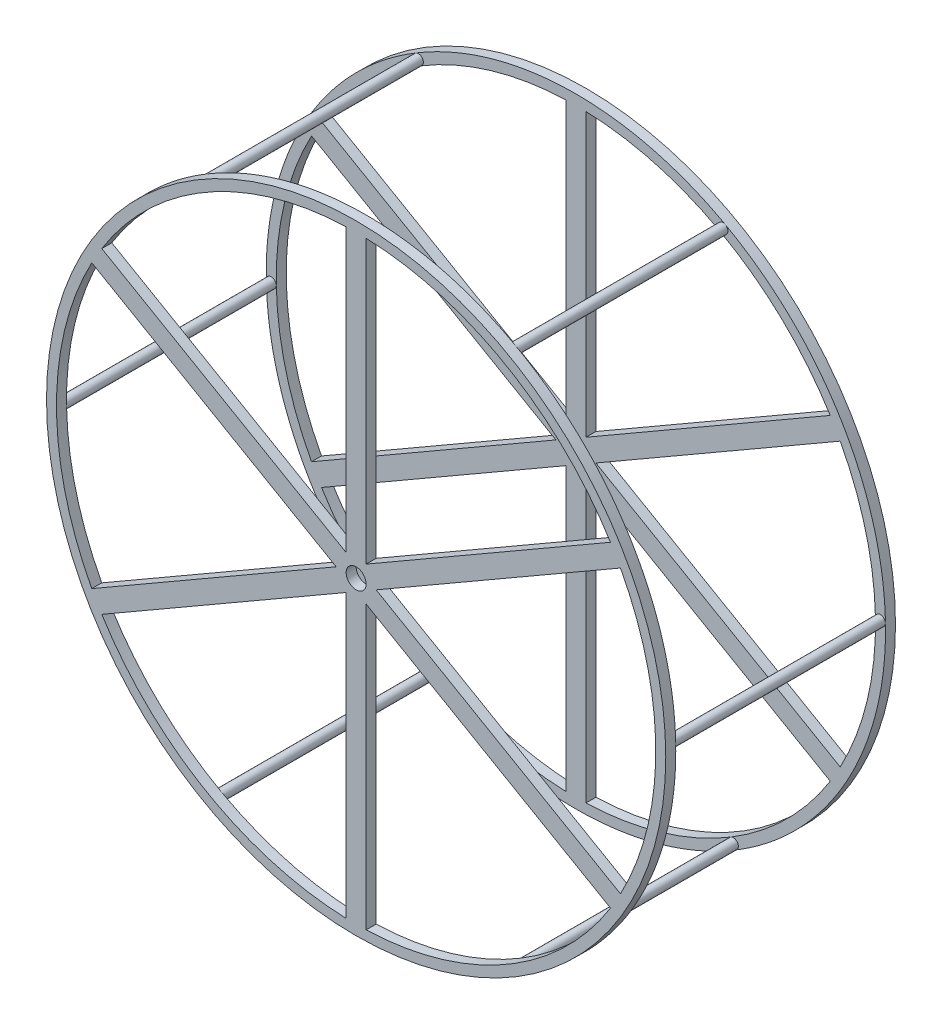
from build123d import *

# Parameters (mm, degrees)
SKETCH1_R               = 155
SKETCH1_R_2             = 150
BOSS_EXTRUDE1_DEPTH     = 115
SKETCH4_W               = 10
SKETCH4_H               = 300
BOSS_EXTRUDE3_DEPTH     = 115
CIRPATTERN1_COUNT       = 3
CIRPATTERN1_ANGLE       = 120
CUT_EXTRUDE1_DEPTH      = 248.53787589
CUT_EXTRUDE1_DEPTH_BACK = 248.53787589
SKETCH2_W               = 105
SKETCH2_H               = 310
SKETCH3_R               = 2.499991986
BOSS_EXTRUDE2_DEPTH     = 105
CIRPATTERN2_COUNT       = 6
CUT_EXTRUDE2_DEPTH      = 248.53787589
CUT_EXTRUDE2_DEPTH_BACK = 248.53787589
SKETCH5_R               = 5


with BuildPart() as part:
    # Sketch1 → Boss-Extrude1 (new body)
    with BuildSketch(Plane.XY):
        Circle(SKETCH1_R)
        Circle(SKETCH1_R_2, mode=Mode.SUBTRACT)
    extrude(amount=BOSS_EXTRUDE1_DEPTH)

    # Sketch4 → Boss-Extrude3 (add)
    with BuildSketch(Plane(origin=(0, 0, 0), x_dir=(-1, 0, 0), z_dir=(0, 0, -1))):
        Rectangle(SKETCH4_W, SKETCH4_H)
    boss_extrude3 = extrude(amount=-BOSS_EXTRUDE3_DEPTH)

    # CirPattern1: Boss-Extrude3 ×3 about axis
    cirpattern1_axis = Axis((0, 0, 0), (0, 0, 1))
    for i in range(1, CIRPATTERN1_COUNT):
        add(boss_extrude3.rotate(cirpattern1_axis, i * CIRPATTERN1_ANGLE / (CIRPATTERN1_COUNT - 1)))

    # Sketch2 → Cut-Extrude1 (cut, two sides: drawn at the far end of the back side and taken through both)
    with BuildSketch(Plane(origin=(0, 0, 0), x_dir=(0, 0, -1), z_dir=(1, 0, 0)).offset(-CUT_EXTRUDE1_DEPTH_BACK)):
        with Locations((-57.5, 0)):
            Rectangle(SKETCH2_W, SKETCH2_H)
    extrude(amount=CUT_EXTRUDE1_DEPTH + CUT_EXTRUDE1_DEPTH_BACK, mode=Mode.SUBTRACT)


with BuildPart() as cut_extrude1_piece_1:
    # of the separate pieces the step leaves, piece 1, a body of its own (cut_extrude1_pieces)
    add(part.part.solids().sort_by_distance((155, 0, 110))[0])



with BuildPart() as cut_extrude1_piece_2:
    # of the separate pieces the step leaves, piece 2, a body of its own (cut_extrude1_pieces)
    add(part.part.solids().sort_by_distance((155, 0, 0))[0])


with BuildPart() as cut_extrude1_piece_1_1:
    add(cut_extrude1_piece_1.part)

    add(cut_extrude1_piece_2.part)  # Boss-Extrude2 merges Cut-Extrude1 piece 2
    # Sketch3 → Boss-Extrude2 (add)
    with BuildSketch(Plane(origin=(0, 0, 110), x_dir=(-1, 0, 0), z_dir=(0, 0, -1))):
        with Locations(Location((78.846059419, 130.535613799, 0), (0, 0, 238.866694375))):
            Circle(SKETCH3_R)
    boss_extrude2 = extrude(amount=BOSS_EXTRUDE2_DEPTH)

    # CirPattern2: Boss-Extrude2 ×6 about axis
    cirpattern2_axis = Axis((0, 0, 0), (0, 0, 1))
    for i in range(1, CIRPATTERN2_COUNT):
        add(boss_extrude2.rotate(cirpattern2_axis, i * 360 / CIRPATTERN2_COUNT))

    # Sketch5 → Cut-Extrude2 (cut, two sides: drawn at the far end of the back side and taken through both)
    with BuildSketch(Plane(origin=(0, 0, 0), x_dir=(-1, 0, 0), z_dir=(0, 0, -1)).offset(-CUT_EXTRUDE2_DEPTH_BACK)):
        with Locations(Location((0, 0, 0), (0, 0, 90))):
            Circle(SKETCH5_R)
    extrude(amount=CUT_EXTRUDE2_DEPTH + CUT_EXTRUDE2_DEPTH_BACK, mode=Mode.SUBTRACT)


solid = cut_extrude1_piece_1_1.part
